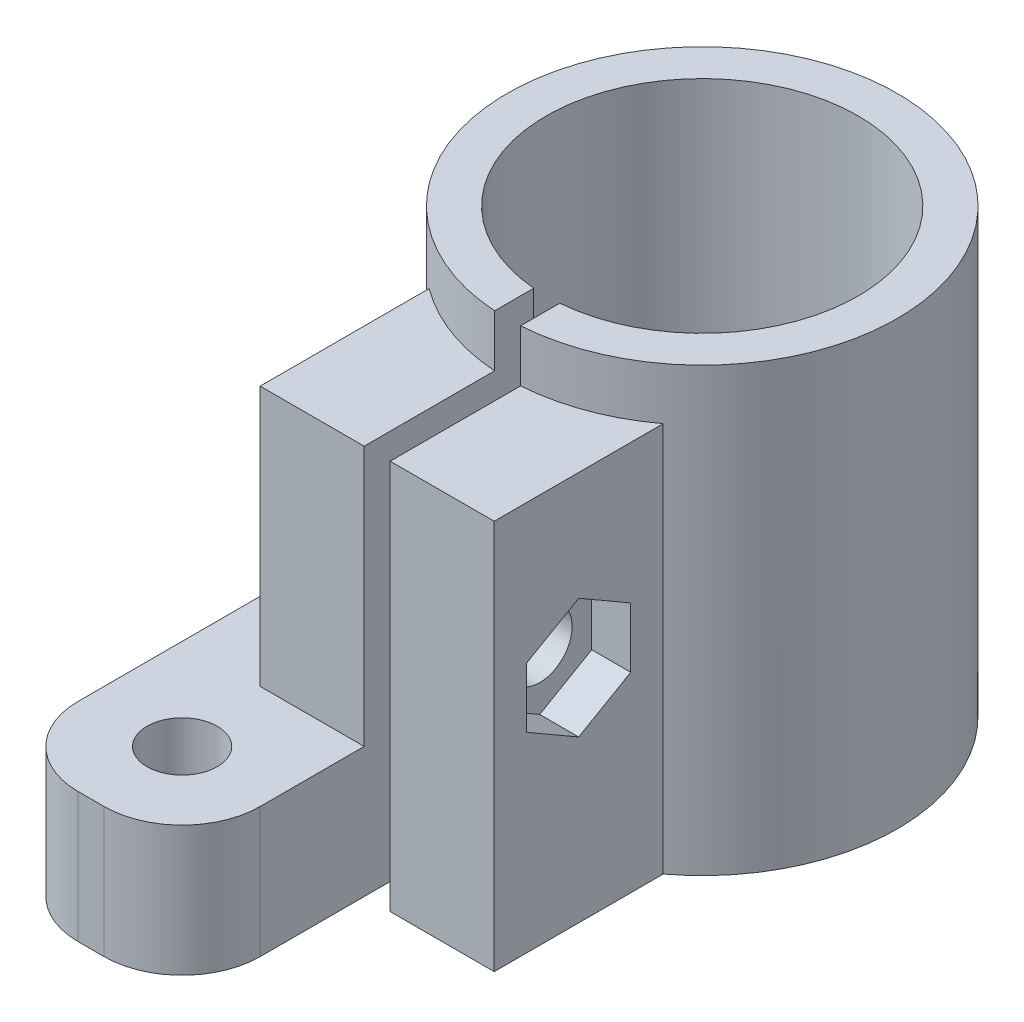
from build123d import *

# Parameters (mm, degrees)
SKETCH_1_R                  = 7.5
SKETCH_1_R_2                = 6
EXTRUDE_1_DEPTH             = 17
CUT_EXTRUDE_1_REACH         = 25.88
CUT_EXTRUDE_1_END_RADIUS    = 6
SKETCH_2_W                  = 1
SKETCH_2_H                  = 17
SKETCH_3_W                  = 4
SKETCH_3_H                  = 17
EXTRUDE_2_DEPTH             = 5
EXTRUDE_2_DIRECTION_2_REACH = 25.88
CUT_EXTRUDE_START           = -2
CUT_EXTRUDE_4_DEPTH         = 2
CUT_EXTRUDE_2_REACH         = 26.274
SKETCH_4_R                  = 1.25
CUT_EXTRUDE_3_DEPTH         = 1.5
EXTRUDE_3_DEPTH             = 5
CUT_EXTRUDE_5_REACH         = 26.094
SKETCH_9_R                  = 1.35
FILLET_1_R                  = 3


with BuildPart() as part:
    # 草图1 → 凸台-拉伸1 (new body)
    with BuildSketch(Plane(origin=(0, 0, 0), x_dir=(1, 0, 0), z_dir=(0, 1, 0))):
        with Locations(Location((0, 0, 0), (0, 0, 270))):
            Circle(SKETCH_1_R)
        with Locations(Location((0, 0, 0), (0, 0, 270))):
            Circle(SKETCH_1_R_2, mode=Mode.SUBTRACT)
    extrude(amount=EXTRUDE_1_DEPTH)

    # 切除-拉伸1: up to this cylinder (the profile starts outside it)
    cut_extrude_1_end = Plane(origin=(0, 8.5, 0), z_dir=(0, -1, 0)) * Cylinder(CUT_EXTRUDE_1_END_RADIUS, 64.76, mode=Mode.PRIVATE)
    # 草图2 → 切除-拉伸1 (cut, up to the surface)
    with BuildSketch(Plane.XY.offset(7.5), mode=Mode.PRIVATE) as cut_extrude_1_sk1:
        with Locations((0, 8.5)):
            Rectangle(SKETCH_2_W, SKETCH_2_H)
    cut_extrude_1_tool1 = extrude(cut_extrude_1_sk1.sketch, amount=-CUT_EXTRUDE_1_REACH, mode=Mode.PRIVATE) - cut_extrude_1_end
    add(cut_extrude_1_tool1.solids().sort_by_distance((0, 8.5, 7.5))[0], mode=Mode.SUBTRACT)

    # 草图3 → 凸台-拉伸2 (add)
    with BuildSketch(Plane.XY.offset(7.5)):
        with Locations((-2.5, 8.5)):
            Rectangle(SKETCH_3_W, SKETCH_3_H)
        with Locations((2.5, 8.5)):
            Rectangle(SKETCH_3_W, SKETCH_3_H)
    extrude(amount=EXTRUDE_2_DEPTH)

    # 草图3 → 凸台-拉伸2 direction 2 (add, up to next)
    with BuildSketch(Plane.XY.offset(7.5), mode=Mode.PRIVATE) as extrude_2_direction_2_sk1:
        with Locations((-2.5, 8.5)):
            Rectangle(SKETCH_3_W, SKETCH_3_H)
    extrude_2_direction_2_tool1 = extrude(extrude_2_direction_2_sk1.sketch, amount=-EXTRUDE_2_DIRECTION_2_REACH, mode=Mode.PRIVATE) - part.part
    # 草图3 → 凸台-拉伸2 direction 2 (add, up to next)
    with BuildSketch(Plane.XY.offset(7.5), mode=Mode.PRIVATE) as extrude_2_direction_2_sk2:
        with Locations((2.5, 8.5)):
            Rectangle(SKETCH_3_W, SKETCH_3_H)
    extrude_2_direction_2_tool2 = extrude(extrude_2_direction_2_sk2.sketch, amount=-EXTRUDE_2_DIRECTION_2_REACH, mode=Mode.PRIVATE) - part.part
    add(extrude_2_direction_2_tool1.solids().sort_by_distance((-2.5, 8.5, 7.5))[0])
    add(extrude_2_direction_2_tool2.solids().sort_by_distance((2.5, 8.5, 7.5))[0])

    # 草图7 → 切除-拉伸4 (cut)
    with BuildSketch(Plane(origin=(0, 17, 0), x_dir=(1, 0, 0), z_dir=(0, 1, 0)).offset(CUT_EXTRUDE_START)):
        with BuildLine():
            Line((-4.5, -6), (-4.5, -12.5))
            Line((-4.5, -12.5), (4.5, -12.5))
            Line((4.5, -12.5), (4.5, -6))
            ThreePointArc((4.5, -6), (0, -7.5), (-4.5, -6))
        make_face()
    extrude(amount=CUT_EXTRUDE_4_DEPTH, mode=Mode.SUBTRACT)

    # 切除-拉伸2: up to this face of the body (flat: up to its plane)
    cut_extrude_2_end = Plane(part.part.faces().sort_by_distance((4.5, 7.5, 9.25))[0])
    # 草图4 → 切除-拉伸2 (cut, up to the picked face)
    with BuildSketch(Plane.ZY.offset(4.5), mode=Mode.PRIVATE) as cut_extrude_2_sk1:
        with Locations(Location((9.25, 8.5, 0), (0, 0, 270))):
            Circle(SKETCH_4_R)
    cut_extrude_2_tool1 = split(extrude(cut_extrude_2_sk1.sketch, amount=-CUT_EXTRUDE_2_REACH, mode=Mode.PRIVATE), bisect_by=cut_extrude_2_end, keep=Keep.BOTH, mode=Mode.PRIVATE)
    add(cut_extrude_2_tool1.solids().sort_by(Axis((-4.5, 8.5, 9.25), (1, 0, 0)))[0], mode=Mode.SUBTRACT)

    # 草图5 → 切除-拉伸3 (cut)
    with BuildSketch(Plane(origin=(4.5, 0, 0), x_dir=(0, 0, -1), z_dir=(1, 0, 0))):
        Polygon((-9.25, 6.190598923), (-7.25, 7.345299462), (-7.25, 9.654700538), (-9.25, 10.809401077), (-11.25, 9.654700538), (-11.25, 7.345299462), align=None)
    extrude(amount=-CUT_EXTRUDE_3_DEPTH, mode=Mode.SUBTRACT)

    # 草图8 → 凸台-拉伸3 (add)
    with BuildSketch(Plane(origin=(0, 0, 0), x_dir=(1, 0, 0), z_dir=(0, 1, 0))):
        Polygon((-7.5, 0), (-7.5, -19.5), (-0.5, -19.5), (-0.5, -12.5), (-4.5, -12.5), (-4.5, -6), align=None)
    extrude(amount=EXTRUDE_3_DEPTH)

    # 草图9 → 切除-拉伸5 (cut, up to next)
    with BuildSketch(Plane(origin=(0, 5, 0), x_dir=(1, 0, 0), z_dir=(0, 1, 0)), mode=Mode.PRIVATE) as cut_extrude_5_sk1:
        with Locations(Location((-4, -16, 0), (0, 0, 270))):
            Circle(SKETCH_9_R)
    cut_extrude_5_tool1 = extrude(cut_extrude_5_sk1.sketch, amount=-CUT_EXTRUDE_5_REACH, mode=Mode.PRIVATE) & part.part
    add(cut_extrude_5_tool1.solids().sort_by_distance((-4, 5, 16))[0], mode=Mode.SUBTRACT)

    # 圆角1
    fillet_1_edges = [part.edges().sort_by_distance(p)[0] for p in [
        (-7.5, 2.5, 19.5),
        (-0.5, 2.5, 19.5),
    ]]
    fillet(fillet_1_edges, radius=FILLET_1_R)


solid = part.part
